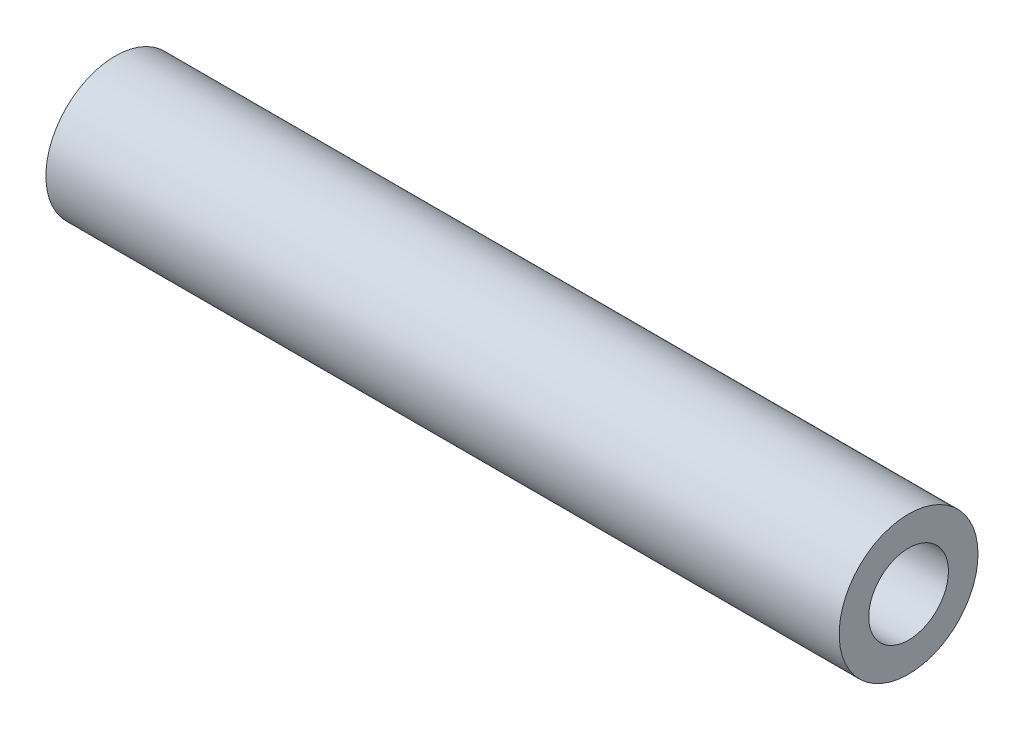
from build123d import *

# Parameters (mm, degrees)
SKETCH1_R           = 4.445
SKETCH1_R_2         = 2.5527
BOSS_EXTRUDE1_DEPTH = 25.4


with BuildPart() as part:
    # Sketch1 → Boss-Extrude1 (new, symmetric)
    with BuildSketch(Plane(origin=(0, 0, 0), x_dir=(0, 0, -1), z_dir=(1, 0, 0))):
        Circle(SKETCH1_R)
        Circle(SKETCH1_R_2, mode=Mode.SUBTRACT)
    extrude(amount=BOSS_EXTRUDE1_DEPTH, both=True)


solid = part.part
